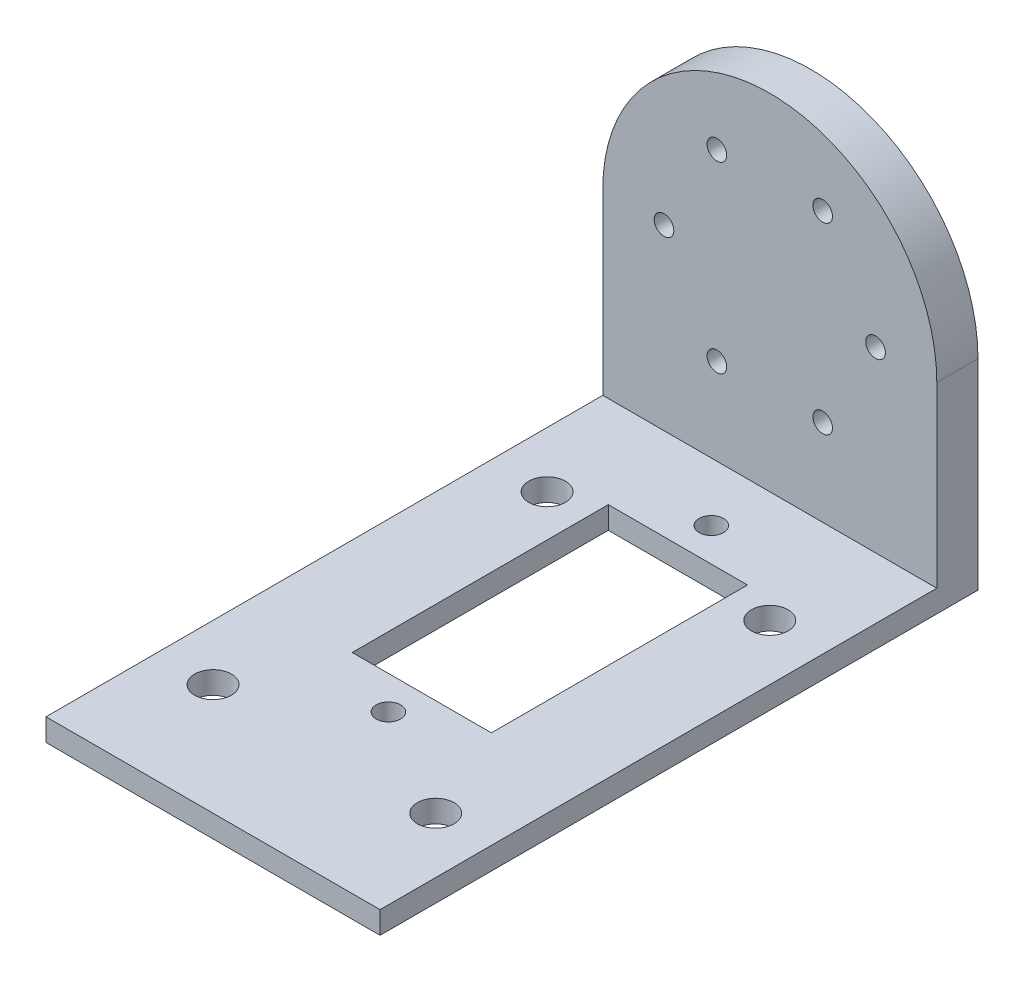
from build123d import *

# Parameters (mm, degrees)
SKETCH_1_R      = 0.88
EXTRUDE_1_DEPTH = 3.7
SKETCH_3_W      = 30
SKETCH_3_H      = 50
SKETCH_3_R      = 1.65
SKETCH_3_R_2    = 1.1
EXTRUDE_2_DEPTH = 2


with BuildPart() as part:
    # 草图1 → 凸台-拉伸1 (new body)
    with BuildSketch(Plane.XY):
        with BuildLine():
            Line((-15, 0), (-15, -18))
            Line((-15, -18), (15, -18))
            Line((15, -18), (15, 0))
            ThreePointArc((15, 0), (0, 15), (-15, 0))
        make_face()
        with Locations((9.5, 0)):
            Circle(SKETCH_1_R, mode=Mode.SUBTRACT)
        with Locations((4.75, -8.227241336)):
            Circle(SKETCH_1_R, mode=Mode.SUBTRACT)
        with Locations((-4.75, -8.227241336)):
            Circle(SKETCH_1_R, mode=Mode.SUBTRACT)
        with Locations((-9.5, 0)):
            Circle(SKETCH_1_R, mode=Mode.SUBTRACT)
        with Locations((-4.75, 8.227241336)):
            Circle(SKETCH_1_R, mode=Mode.SUBTRACT)
        with Locations((4.75, 8.227241336)):
            Circle(SKETCH_1_R, mode=Mode.SUBTRACT)
    extrude(amount=EXTRUDE_1_DEPTH)

    # 草图3 → 凸台-拉伸2 (add)
    with BuildSketch(Plane(origin=(0, -18, 0), x_dir=(1, 0, 0), z_dir=(0, 1, 0))):
        with Locations((0, -28.7)):
            Rectangle(SKETCH_3_W, SKETCH_3_H)
        with Locations(Location((-10, -13.7, 0), (0, 0, 270))):
            Circle(SKETCH_3_R, mode=Mode.SUBTRACT)
        with Locations(Location((10, -13.7, 0), (0, 0, 90))):
            Circle(SKETCH_3_R, mode=Mode.SUBTRACT)
        with Locations(Location((10, -43.7, 0), (0, 0, 270))):
            Circle(SKETCH_3_R, mode=Mode.SUBTRACT)
        with Locations(Location((-10, -43.7, 0), (0, 0, 90))):
            Circle(SKETCH_3_R, mode=Mode.SUBTRACT)
        with Locations(Location((0, -8.95, 0), (0, 0, 270))):
            Circle(SKETCH_3_R_2, mode=Mode.SUBTRACT)
        with Locations(Location((0, -37.95, 0), (0, 0, 270))):
            Circle(SKETCH_3_R_2, mode=Mode.SUBTRACT)
        Polygon((-6.25, -28.7), (-6.25, -11.95), (6.25, -11.95), (6.25, -28.7), (6.25, -34.95), (-6.25, -34.95), align=None, mode=Mode.SUBTRACT)
    extrude(amount=EXTRUDE_2_DEPTH)


solid = part.part
